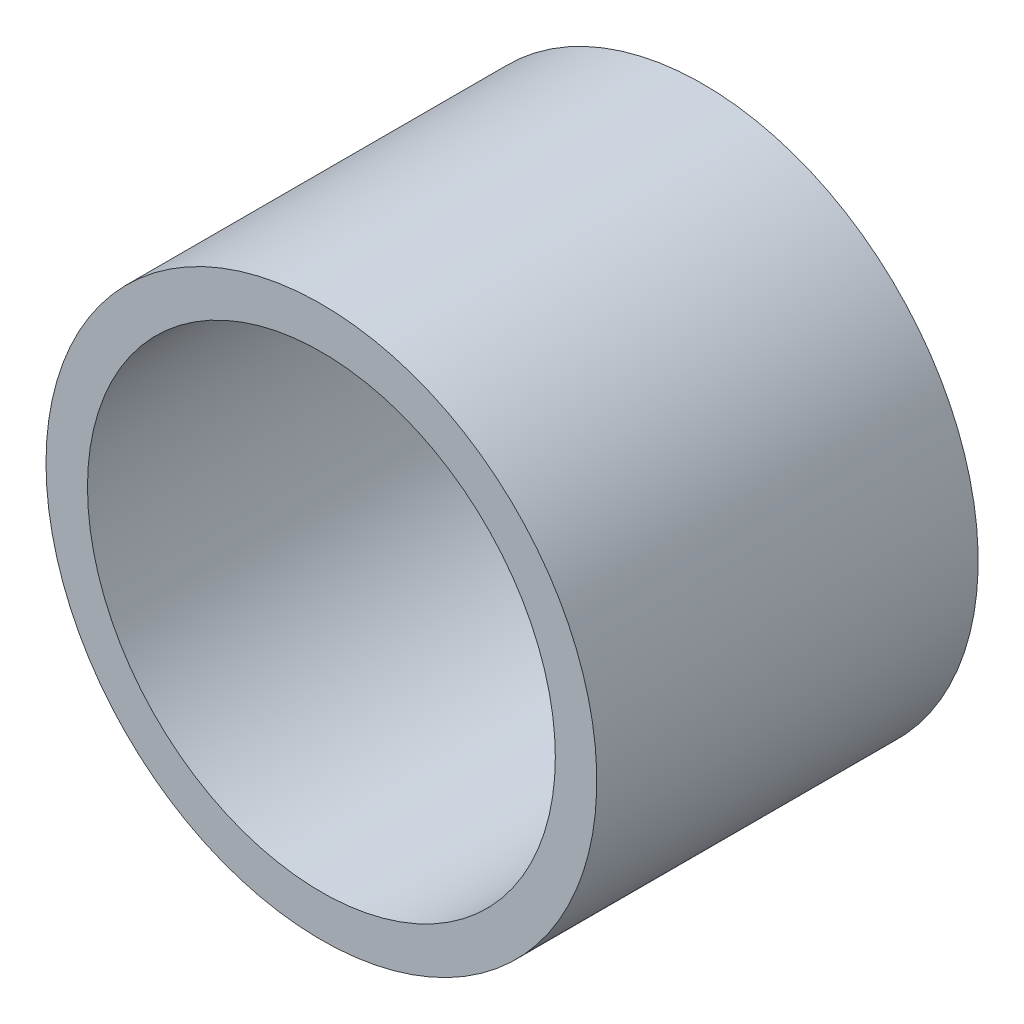
from build123d import *

# Parameters (mm, degrees)
SKETCH1_R           = 32.375
SKETCH1_R_2         = 27.5
BOSS_EXTRUDE1_DEPTH = 44.831


with BuildPart() as part:
    # Sketch1 → Boss-Extrude1 (new body)
    with BuildSketch(Plane.XY):
        with Locations(Location((0, 0, 0), (0, 0, 180))):
            Circle(SKETCH1_R)
        with Locations(Location((0, 0, 0), (0, 0, 180))):
            Circle(SKETCH1_R_2, mode=Mode.SUBTRACT)
    extrude(amount=BOSS_EXTRUDE1_DEPTH)


solid = part.part
